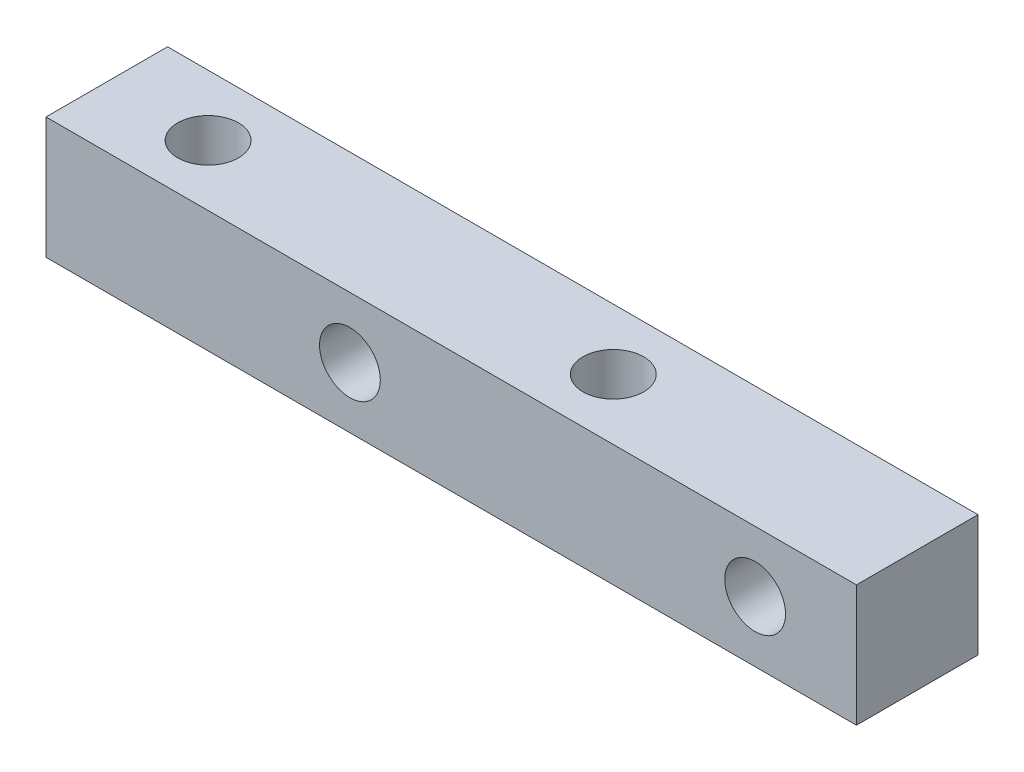
from build123d import *

# Parameters (mm, degrees)
SKETCH_1_W          = 40
SKETCH_1_H          = 6
EXTRUDE_1_DEPTH     = 6
SKETCH_2_R          = 1.5
CUT_EXTRUDE_1_DEPTH = 6
SKETCH_3_R          = 1.5
CUT_EXTRUDE_2_DEPTH = 6


with BuildPart() as part:
    # 草图1 → 凸台-拉伸1 (new body)
    with BuildSketch(Plane.XY):
        Rectangle(SKETCH_1_W, SKETCH_1_H)
    extrude(amount=EXTRUDE_1_DEPTH)

    # 草图2 → 切除-拉伸1 (cut)
    with BuildSketch(Plane(origin=(0, 3, 0), x_dir=(1, 0, 0), z_dir=(0, 1, 0))):
        with Locations(Location((-15, -3, 0), (0, 0, 270))):
            Circle(SKETCH_2_R)
        with Locations(Location((5, -3, 0), (0, 0, 270))):
            Circle(SKETCH_2_R)
    extrude(amount=-CUT_EXTRUDE_1_DEPTH, mode=Mode.SUBTRACT)

    # 草图3 → 切除-拉伸2 (cut)
    with BuildSketch(Plane.XY.offset(6)):
        with Locations((-5, 0)):
            Circle(SKETCH_3_R)
        with Locations((15, 0)):
            Circle(SKETCH_3_R)
    extrude(amount=-CUT_EXTRUDE_2_DEPTH, mode=Mode.SUBTRACT)


solid = part.part
